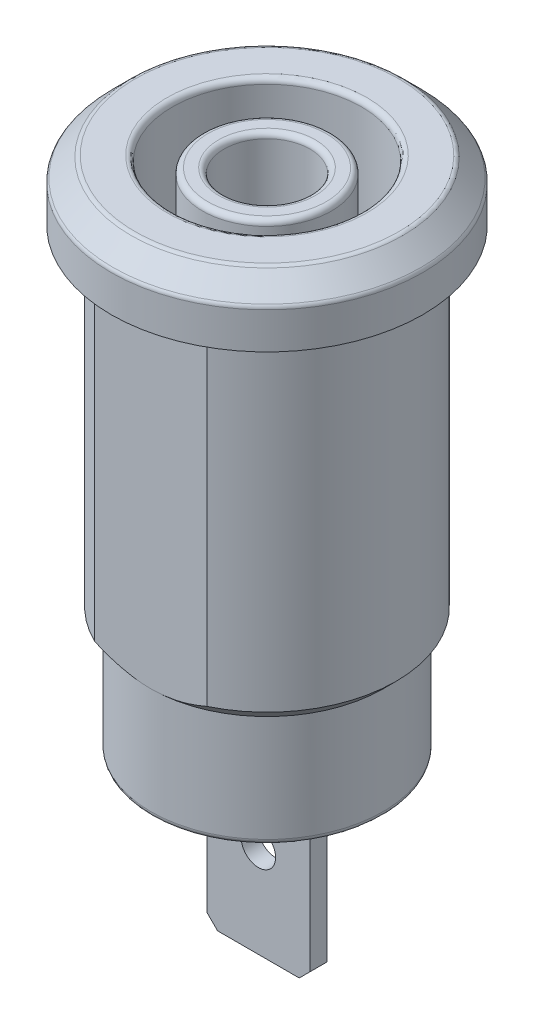
from build123d import *

# Parameters (mm, degrees)
SKETCH2_R           = 0.8
BOSS_EXTRUDE1_DEPTH = 0.4
SKETCH3_OUTSIDE_W   = 24.102
SKETCH3_OUTSIDE_H   = 24.102
CUT_EXTRUDE1_DEPTH  = 21.2
FILLET1_R           = 0.25


with BuildPart() as part:
    # Sketch1 → Revolve1 (revolve)
    with BuildSketch(Plane.XY, mode=Mode.PRIVATE) as revolve1_sk:
        Polygon((-6.25, 0), (-7.25, -1), (-7.25, -2.8), (-6, -2.8), (-6, -18.2), (-5.4, -18.8), (-5.4, -24), (0, -24), (0, -21.154700538), (-2, -20), (-2, -0.5), (-3, -0.5), (-3, -21.5), (-4.4, -21.5), (-4.4, 0), align=None)
    revolve(revolve1_sk.sketch.rotate(Axis((0, -24, 0), (0, 1, 0)), 270), axis=Axis((0, -24, 0), (0, 1, 0)))

    # Sketch2 → Boss-Extrude1 (add, symmetric)
    with BuildSketch(Plane.XY):
        Polygon((-2.4, -24), (-2.4, -31.5), (-1.9, -32), (1.9, -32), (2.4, -31.5), (2.4, -24), align=None)
        with Locations((0, -27.7)):
            Circle(SKETCH2_R, mode=Mode.SUBTRACT)
    extrude(amount=BOSS_EXTRUDE1_DEPTH, both=True)

    # Sketch3 outside → Cut-Extrude1 (cut)
    with BuildSketch(Plane.XZ.offset(24)):
        Rectangle(SKETCH3_OUTSIDE_W, SKETCH3_OUTSIDE_H)
        with BuildLine():
            Line((2.615339366, 5.4), (-2.615339366, 5.4))
            ThreePointArc((-2.615339366, 5.4), (-6, 0), (-2.615339366, -5.4))
            Line((-2.615339366, -5.4), (2.615339366, -5.4))
            ThreePointArc((2.615339366, -5.4), (6, 0), (2.615339366, 5.4))
        make_face(mode=Mode.SUBTRACT)
    extrude(amount=-CUT_EXTRUDE1_DEPTH, mode=Mode.SUBTRACT)

    # Fillet1
    fillet1_edges = [part.edges().sort_by_distance(p)[0] for p in [
        (0, 0, 4.4),
        (0, -21.5, 4.4),
        (0, -21.5, 3),
        (0, -0.5, 3),
        (0, -0.5, 2),
        (0, -20, 2),
        (0, -24, 5.4),
        (0, -1, 7.25),
        (0, 0, 6.25),
    ]]
    fillet(fillet1_edges, radius=FILLET1_R)


solid = part.part
